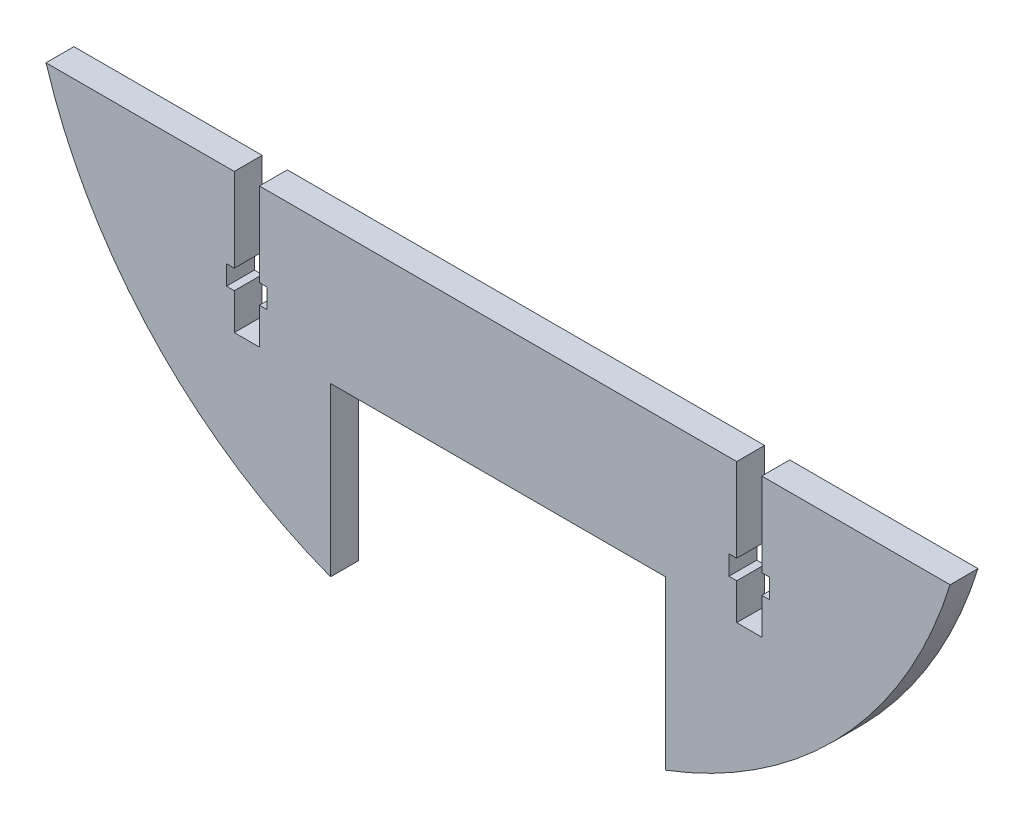
from build123d import *

# Parameters (mm, degrees)
EXTRUDE_1_DEPTH = 5


with BuildPart() as part:
    # 草图1 → 凸台-拉伸1 (new body)
    with BuildSketch(Plane.XY):
        with BuildLine():
            Line((-80.978778084, -25), (-47.25, -25))
            Line((-47.25, -25), (-47.25, -40))
            Line((-47.25, -40), (-48.65, -40))
            Line((-48.65, -40), (-48.65, -43.5))
            Line((-48.65, -43.5), (-47.25, -43.5))
            Line((-47.25, -43.5), (-47.25, -50))
            Line((-47.25, -50), (-42.75, -50))
            Line((-42.75, -50), (-42.75, -43.5))
            Line((-42.75, -43.5), (-41.35, -43.5))
            Line((-41.35, -43.5), (-41.35, -40))
            Line((-41.35, -40), (-42.75, -40))
            Line((-42.75, -40), (-42.75, -25))
            Line((-42.75, -25), (42.75, -25))
            Line((42.75, -25), (42.75, -40))
            Line((42.75, -40), (41.35, -40))
            Line((41.35, -40), (41.35, -43.5))
            Line((41.35, -43.5), (42.75, -43.5))
            Line((42.75, -43.5), (42.75, -50))
            Line((42.75, -50), (47.25, -50))
            Line((47.25, -50), (47.25, -43.5))
            Line((47.25, -43.5), (48.65, -43.5))
            Line((48.65, -43.5), (48.65, -40))
            Line((48.65, -40), (47.25, -40))
            Line((47.25, -40), (47.25, -25))
            Line((47.25, -25), (80.978778084, -25))
            ThreePointArc((80.978778084, -25), (61.76714503, -58.029150389), (30, -79.262617292))
            Line((30, -79.262617292), (30, -49.262617292))
            Line((30, -49.262617292), (-30, -49.262617292))
            Line((-30, -49.262617292), (-30, -79.262617292))
            ThreePointArc((-30, -79.262617292), (-61.76714503, -58.029150389), (-80.978778084, -25))
        make_face()
    extrude(amount=EXTRUDE_1_DEPTH)


solid = part.part
